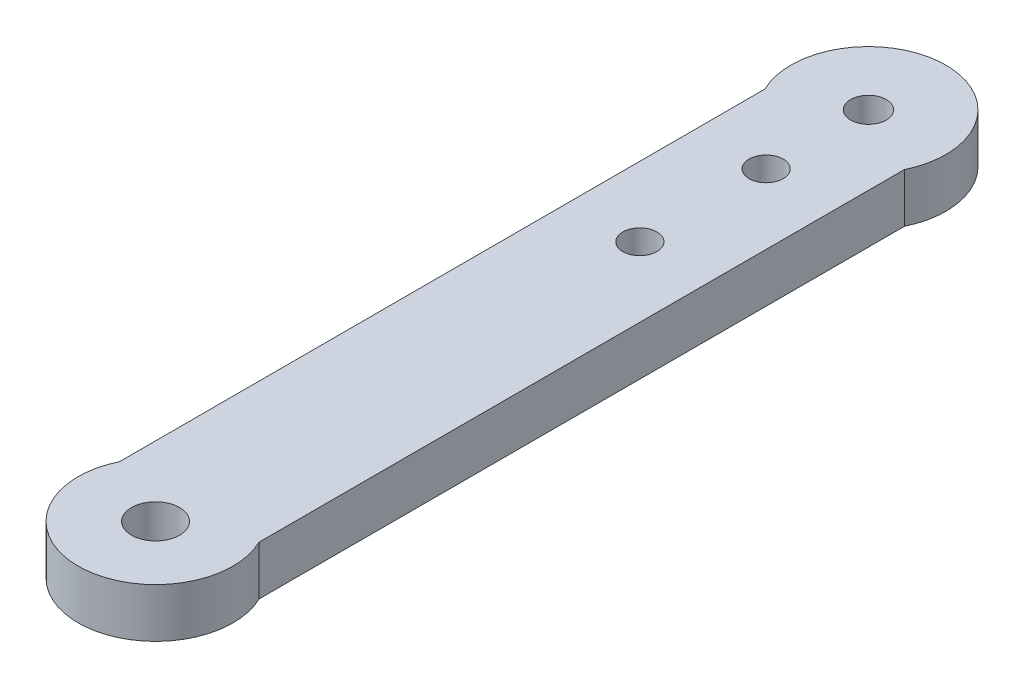
from build123d import *

# Parameters (mm, degrees)
SKETCH1_R           = 1.55
SKETCH1_R_2         = 1.1
SKETCH1_R_3         = 1.15
BOSS_EXTRUDE1_DEPTH = 3.175


with BuildPart() as part:
    # Sketch1 → Boss-Extrude1 (new body)
    with BuildSketch(Plane(origin=(0, 0, 0), x_dir=(1, 0, 0), z_dir=(0, 1, 0))):
        with BuildLine():
            Line((-4.5, -43.820550528), (-4.5, -2.179449472))
            ThreePointArc((-4.5, -2.179449472), (0, 5), (4.5, -2.179449472))
            Line((4.5, -2.179449472), (4.5, -43.820550528))
            ThreePointArc((4.5, -43.820550528), (0, -51), (-4.5, -43.820550528))
        make_face()
        with Locations(Location((0, -46, 0), (0, 0, 270))):
            Circle(SKETCH1_R, mode=Mode.SUBTRACT)
        with Locations(Location((0, -6.6, 0), (0, 0, 270))):
            Circle(SKETCH1_R_2, mode=Mode.SUBTRACT)
        with Locations(Location((0, -14.75, 0), (0, 0, 270))):
            Circle(SKETCH1_R_2, mode=Mode.SUBTRACT)
        with Locations(Location((0, 0, 0), (0, 0, 270))):
            Circle(SKETCH1_R_3, mode=Mode.SUBTRACT)
    extrude(amount=BOSS_EXTRUDE1_DEPTH)


solid = part.part
